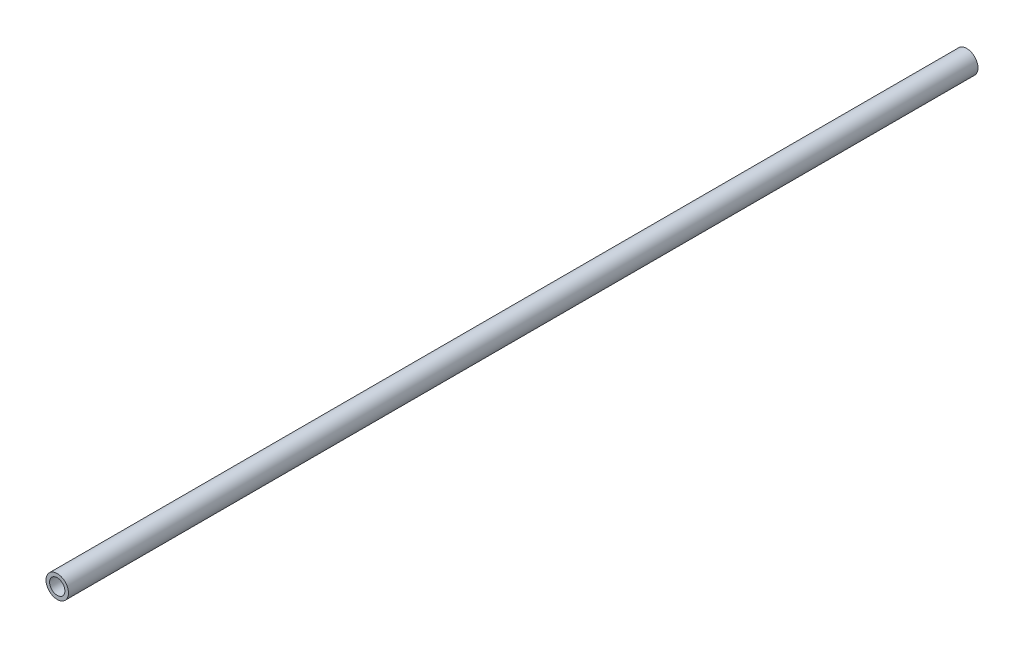
from build123d import *

# Parameters (mm, degrees)
SCHIZZO1_R                   = 2.5
ESTRUSIONE_ESTRUSIONE1_DEPTH = 202
FORO_PER_VITE_M3_1_D         = 3.4
FORO_PER_VITE_M3_1_DEPTH     = 9.978536948
FORO_PER_VITE_M3_1_TIP       = 1.021463052
FORO_PER_VITE_M3_2_D         = 3.4
FORO_PER_VITE_M3_2_DEPTH     = 9.978536948
FORO_PER_VITE_M3_2_TIP       = 1.021463052


with BuildPart() as part:
    # Schizzo1 → Estrusione-Estrusione1 (new body)
    with BuildSketch(Plane.XY):
        Circle(SCHIZZO1_R)
    extrude(amount=-ESTRUSIONE_ESTRUSIONE1_DEPTH)

    # Foro per Vite M3-1
    with Locations(Plane.XY):
        with Locations((0, 0)):
            Hole(FORO_PER_VITE_M3_1_D / 2, depth=FORO_PER_VITE_M3_1_DEPTH)
            with Locations((0, 0, -(FORO_PER_VITE_M3_1_DEPTH + FORO_PER_VITE_M3_1_TIP / 2))):  # 118° drill point
                Cone(0, FORO_PER_VITE_M3_1_D / 2, FORO_PER_VITE_M3_1_TIP, mode=Mode.SUBTRACT)

    # Foro per Vite M3-2
    with Locations(Plane(origin=(0, 0, -202), x_dir=(-1, 0, 0), z_dir=(0, 0, -1))):
        with Locations((0, 0)):
            Hole(FORO_PER_VITE_M3_2_D / 2, depth=FORO_PER_VITE_M3_2_DEPTH)
            with Locations((0, 0, -(FORO_PER_VITE_M3_2_DEPTH + FORO_PER_VITE_M3_2_TIP / 2))):  # 118° drill point
                Cone(0, FORO_PER_VITE_M3_2_D / 2, FORO_PER_VITE_M3_2_TIP, mode=Mode.SUBTRACT)


solid = part.part
